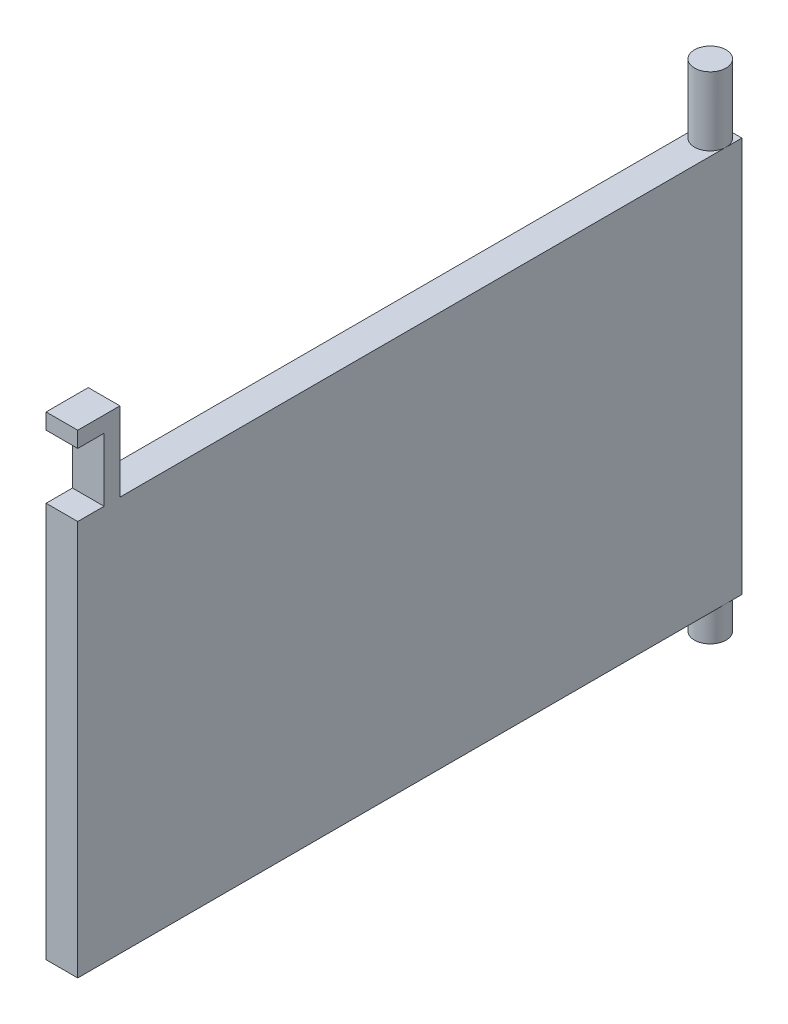
from build123d import *
from build123d.topology import SkipClean

# Parameters (mm, degrees)
SKICA1_W                 = 6
SKICA1_H                 = 100
P_IDAT_VYSUNUT_M1_DEPTH  = 6
SKICA4_OUTSIDE_W         = 28.072
SKICA4_OUTSIDE_H         = 28.072
SKICA4_OUTSIDE_R         = 3
ODEBRAT_VYSUNUT_M3_DEPTH = 15
SKICA6_OUTSIDE_W         = 28.072
SKICA6_OUTSIDE_H         = 28.072
SKICA6_OUTSIDE_R         = 3
ODEBRAT_VYSUNUT_M4_DEPTH = 10
SKICA7_R                 = 3
ODEBRAT_VYSUNUT_M5_DEPTH = 5
SKICA10_R                = 3
P_IDAT_VYSUNUT_M2_DEPTH  = 1
SKICA11_W                = 6
SKICA11_H                = 75
P_IDAT_VYSUNUT_M3_DEPTH  = 120
SKICA14_R                = 3
ODEBRAT_VYSUNUT_M8_DEPTH = 2
SKICA19_W                = 6
SKICA19_H                = 3
P_IDAT_VYSUNUT_M6_DEPTH  = 15
SKICA20_W                = 6
SKICA20_H                = 3
P_IDAT_VYSUNUT_M8_DEPTH  = 5


with BuildPart() as part:
    # Skica1 → Přidat vysunutím1 (new body)
    with BuildSketch(Plane.XY):
        with Locations((3, 50)):
            Rectangle(SKICA1_W, SKICA1_H)
    extrude(amount=P_IDAT_VYSUNUT_M1_DEPTH)

    # Skica4 outside → Odebrat vysunutím3 (cut)
    with BuildSketch(Plane(origin=(0, 100, 0), x_dir=(1, 0, 0), z_dir=(0, 1, 0))):
        with Locations((3, -3)):
            Rectangle(SKICA4_OUTSIDE_W, SKICA4_OUTSIDE_H)
        with Locations(Location((3, -3, 0), (0, 0, 270))):
            Circle(SKICA4_OUTSIDE_R, mode=Mode.SUBTRACT)
    extrude(amount=-ODEBRAT_VYSUNUT_M3_DEPTH, mode=Mode.SUBTRACT)

    # Skica6 outside → Odebrat vysunutím4 (cut)
    with BuildSketch(Plane.XZ):
        with Locations((3, 3)):
            Rectangle(SKICA6_OUTSIDE_W, SKICA6_OUTSIDE_H)
        with Locations(Location((3, 3, 0), (0, 0, 90))):
            Circle(SKICA6_OUTSIDE_R, mode=Mode.SUBTRACT)
    extrude(amount=-ODEBRAT_VYSUNUT_M4_DEPTH, mode=Mode.SUBTRACT)

    # Skica7 → Odebrat vysunutím5 (cut)
    with BuildSketch(Plane.XZ):
        with Locations(Location((3, 3, 0), (0, 0, 270))):
            Circle(SKICA7_R)
    extrude(amount=-ODEBRAT_VYSUNUT_M5_DEPTH, mode=Mode.SUBTRACT)

    # Skica10 → Přidat vysunutím2 (add)
    with SkipClean():  # the faces are left unmerged after this step: merging them gives an invalid solid
        with BuildSketch(Plane.XZ.offset(-5)):
            with Locations(Location((3, 3, 0), (0, 0, 270))):
                Circle(SKICA10_R)
        extrude(amount=P_IDAT_VYSUNUT_M2_DEPTH)

    # Skica11 → Přidat vysunutím3 (add)
    with SkipClean():  # the faces are left unmerged after this step: merging them gives an invalid solid
        with BuildSketch(Plane.XY.offset(6)):
            with Locations((3, 47.5)):
                Rectangle(SKICA11_W, SKICA11_H)
        extrude(amount=P_IDAT_VYSUNUT_M3_DEPTH)

    # Skica14 → Odebrat vysunutím8 (cut)
    with SkipClean():  # the faces are left unmerged after this step: merging them gives an invalid solid
        with BuildSketch(Plane(origin=(0, 100, 0), x_dir=(1, 0, 0), z_dir=(0, 1, 0))):
            with Locations(Location((3, -3, 0), (0, 0, 270))):
                Circle(SKICA14_R)
        extrude(amount=-ODEBRAT_VYSUNUT_M8_DEPTH, mode=Mode.SUBTRACT)

    # Skica19 → Přidat vysunutím6 (add)
    with SkipClean():  # the faces are left unmerged after this step: merging them gives an invalid solid
        with BuildSketch(Plane(origin=(0, 85, 0), x_dir=(1, 0, 0), z_dir=(0, 1, 0))):
            with Locations((3, -119.5)):
                Rectangle(SKICA19_W, SKICA19_H)
        extrude(amount=P_IDAT_VYSUNUT_M6_DEPTH)

    # Skica20 → Přidat vysunutím8 (add)
    with SkipClean():  # the faces are left unmerged after this step: merging them gives an invalid solid
        with BuildSketch(Plane.XY.offset(121)):
            with Locations((3, 98.5)):
                Rectangle(SKICA20_W, SKICA20_H)
        extrude(amount=P_IDAT_VYSUNUT_M8_DEPTH)


solid = part.part
